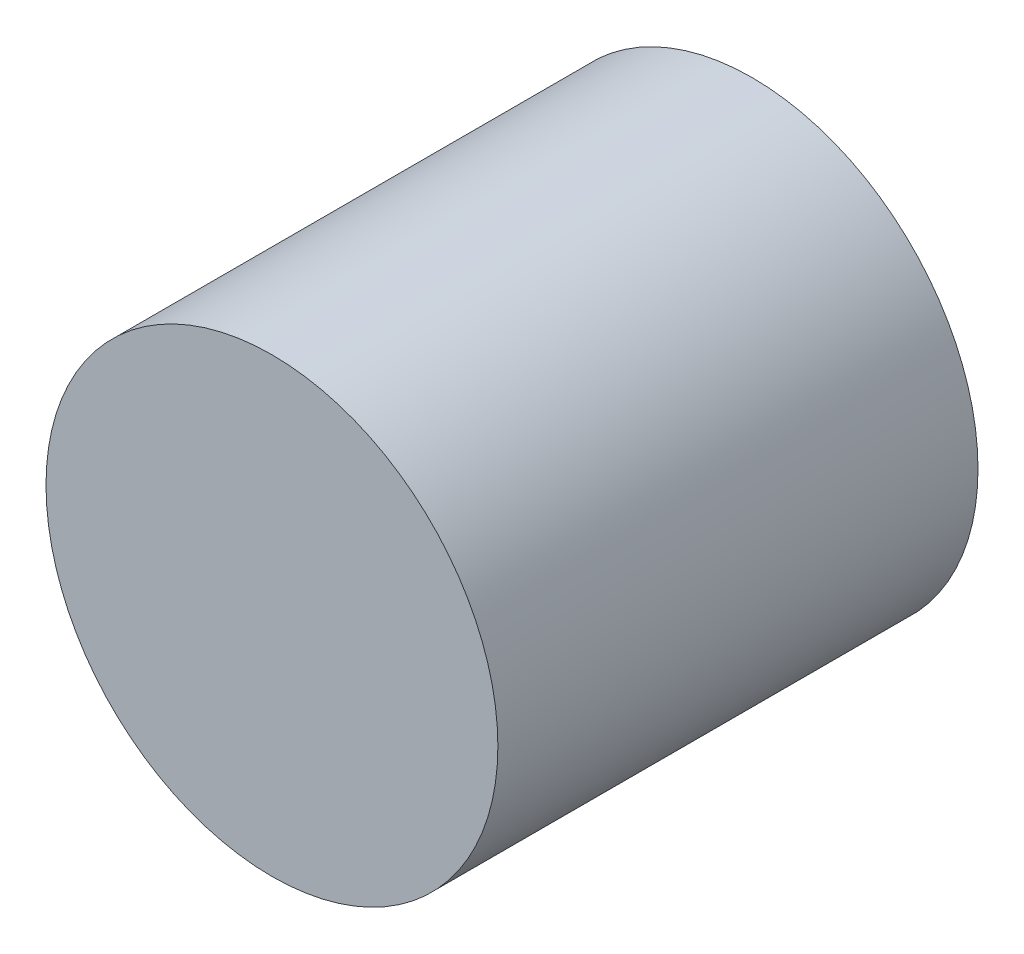
from build123d import *

# Parameters (mm, degrees)
SKETCH1_R           = 4
BOSS_EXTRUDE1_DEPTH = 8.5


with BuildPart() as part:
    # Sketch1 → Boss-Extrude1 (new body)
    with BuildSketch(Plane.XY):
        Circle(SKETCH1_R)
    extrude(amount=BOSS_EXTRUDE1_DEPTH)


solid = part.part
